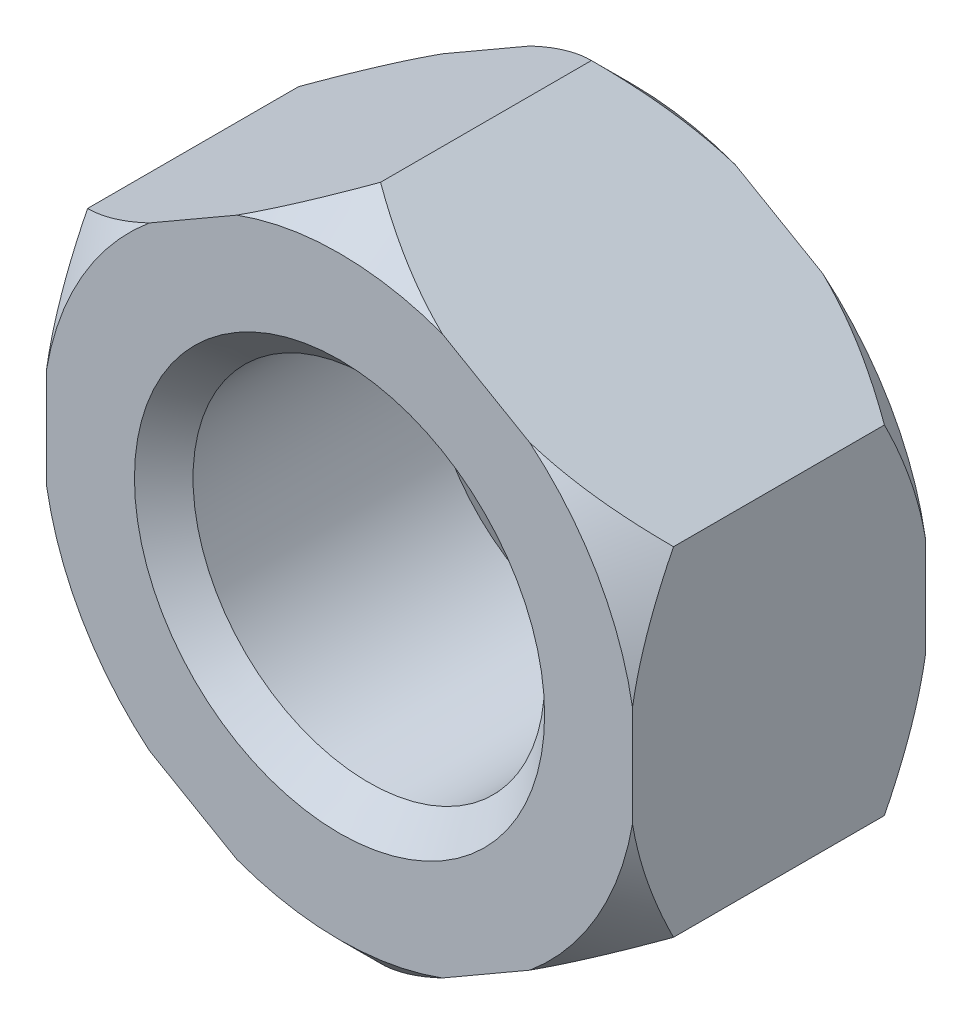
from build123d import *

# Parameters (mm, degrees)
EXTRUDE_1_DEPTH     = 5
SKETCH_2_R          = 3
CUT_EXTRUDE_1_DEPTH = 10.128709292
CHAMFER_1_SIZE      = 0.5


with BuildPart() as part:
    # Эскиз1 → Вытянуть1 (new body)
    with BuildSketch(Plane.XY):
        Polygon((0, 5.773502692), (-5, 2.886751346), (-5, -2.886751346), (0, -5.773502692), (5, -2.886751346), (5, 2.886751346), align=None)
    extrude(amount=EXTRUDE_1_DEPTH)

    # Эскиз15 → Вырез-Повернуть1 (revolve, cut)
    with BuildSketch(Plane(origin=(0, 0, 0), x_dir=(0, 0, -1), z_dir=(1, 0, 0))):
        Polygon((-5, 5.773502692), (-5, 5.073502692), (-4.3, 5.773502692), align=None)
        Polygon((-0.7, 5.773502692), (0, 5.773502692), (0, 5.073502692), align=None)
    revolve(axis=Axis((0, 0, 2.633835381), (0, 0, -1)), mode=Mode.SUBTRACT)

    # Эскиз2 → Вырез-Вытянуть1 (cut, through all)
    with BuildSketch(Plane(origin=(0, 0, 0), x_dir=(-1, 0, 0), z_dir=(0, 0, -1))):
        Circle(SKETCH_2_R)
    extrude(amount=-CUT_EXTRUDE_1_DEPTH, mode=Mode.SUBTRACT)

    # Фаска1
    chamfer_1_edges = [part.edges().sort_by_distance(p)[0] for p in [
        (3, 0, 5),
        (3, 0, 0),
    ]]
    chamfer(chamfer_1_edges, length=CHAMFER_1_SIZE)


solid = part.part
